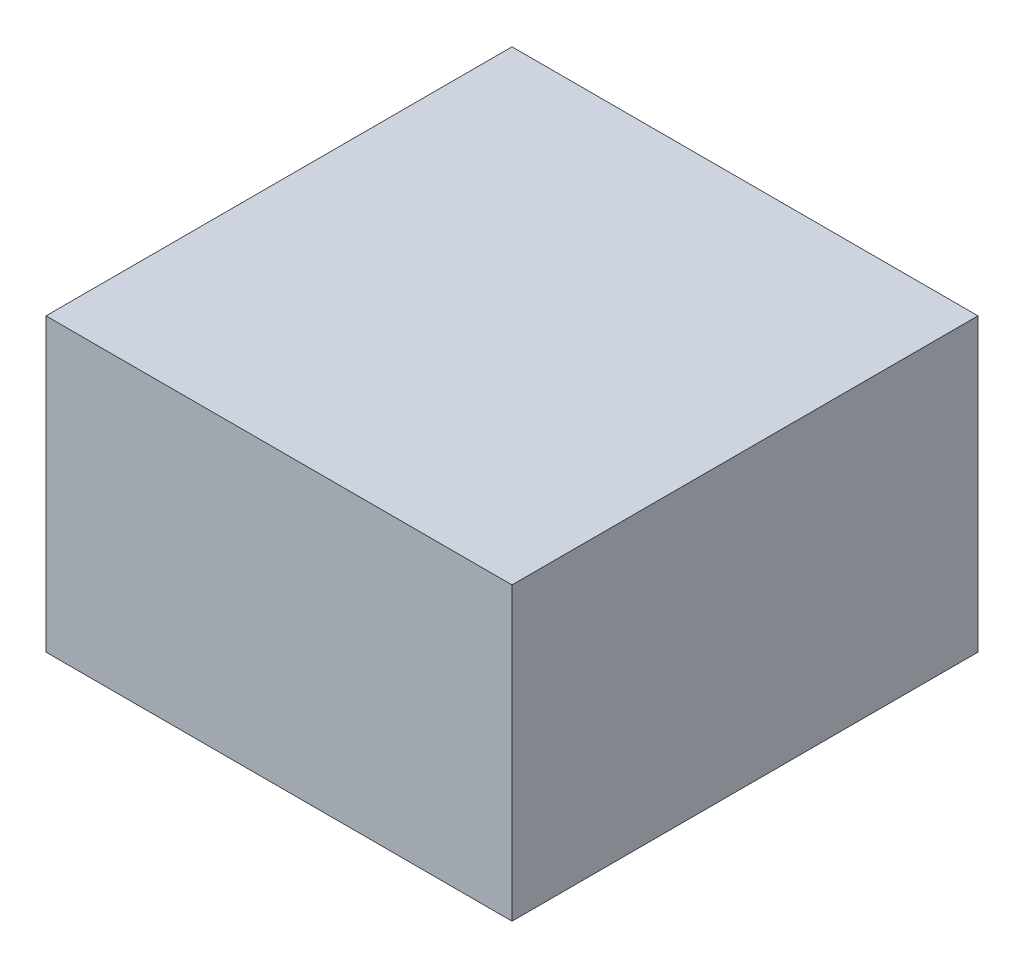
from build123d import *

# Parameters (mm, degrees)
BOSS_EXTRUDE1_DEPTH      = 63.5
BOSS_EXTRUDE1_DEPTH_BACK = 63.5
SKETCH1_W                = 203.2
SKETCH1_H                = 203.2


with BuildPart() as part:
    # Sketch1 → Boss-Extrude1 (new, two sides: drawn at the far end of the back side and taken through both)
    with BuildSketch(Plane(origin=(0, 0, 0), x_dir=(1, 0, 0), z_dir=(0, 1, 0)).offset(-BOSS_EXTRUDE1_DEPTH_BACK)):
        Rectangle(SKETCH1_W, SKETCH1_H)
    extrude(amount=BOSS_EXTRUDE1_DEPTH + BOSS_EXTRUDE1_DEPTH_BACK)


solid = part.part
